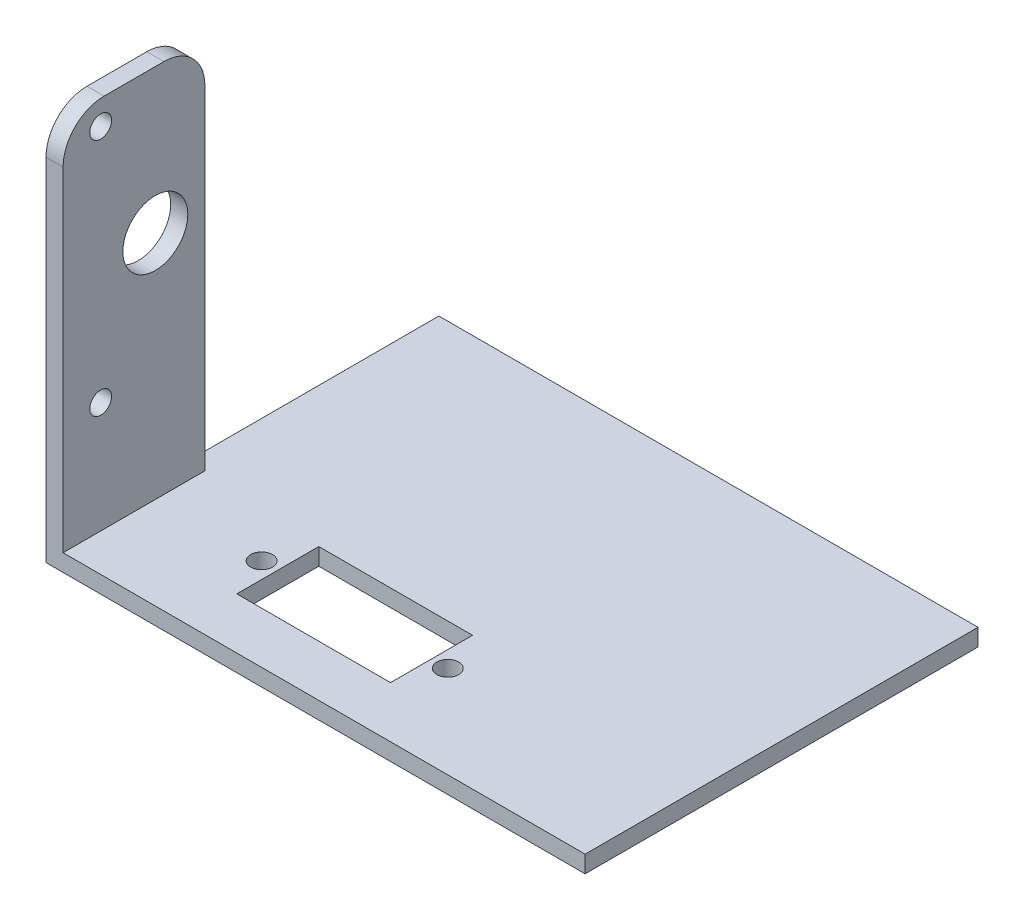
from build123d import *

# Parameters (mm, degrees)
SKETCH1_W               = 80
SKETCH1_H               = 60
BOSS_EXTRUDE1_DEPTH     = 2.5
CUT_EXTRUDE4_DEPTH      = 51.062460986
CUT_EXTRUDE4_DEPTH_BACK = 51.062460986
SKETCH2_R               = 1.6
SKETCH3_W               = 2.5
SKETCH3_H               = 20.5
BOSS_EXTRUDE2_DEPTH     = 66.5
SKETCH4_W               = 80
SKETCH4_H               = 5.5
BOSS_EXTRUDE3_DEPTH     = 2.5
SKETCH5_W               = 2.5
SKETCH5_H               = 5.5
BOSS_EXTRUDE4_DEPTH     = 66.5
SKETCH6_W               = 2.5
SKETCH6_H               = 5.5
CUT_EXTRUDE5_DEPTH      = 66.5
SKETCH9_W               = 2.5
SKETCH9_H               = 2.5
BOSS_EXTRUDE5_DEPTH     = 66.5
SKETCH11_R              = 4.75
CUT_EXTRUDE6_DEPTH      = 2.5
SKETCH15_W              = 2.5
SKETCH15_H              = 23
BOSS_EXTRUDE6_DEPTH     = 8
SKETCH17_W              = 2.5
SKETCH17_H              = 74.5
BOSS_EXTRUDE7_DEPTH     = 2
SKETCH18_R              = 1.6
CUT_EXTRUDE7_DEPTH      = 2.5
SKETCH21_W              = 80
SKETCH21_H              = 2.5
BOSS_EXTRUDE8_DEPTH     = 2
SKETCH22_W              = 4.25
SKETCH22_H              = 74.5
CUT_EXTRUDE8_DEPTH      = 2.5
FILLET1_R               = 5
SKETCH23_W              = 15.225
SKETCH23_H              = 67.5
BOSS_EXTRUDE10_DEPTH    = 2.5
SKETCH24_W              = 95.225
SKETCH24_H              = 10
CUT_EXTRUDE9_DEPTH      = 101.031498164
SKETCH26_W              = 2.5
SKETCH26_H              = 20.75
BOSS_EXTRUDE11_DEPTH    = 74.5
SKETCH27_R              = 1.6
CUT_EXTRUDE10_DEPTH     = 2.5
SKETCH28_W              = 2.5
SKETCH28_H              = 20.75
CUT_EXTRUDE11_DEPTH     = 74.5
SKETCH29_W              = 20.75
SKETCH29_H              = 19.625
CUT_EXTRUDE12_DEPTH     = 2.5
FILLET2_R               = 6
SKETCH31_W              = 13.325
SKETCH31_H              = 57.5
CUT_EXTRUDE13_DEPTH     = 2.5
SKETCH33_W              = 3
SKETCH33_H              = 57.5
CUT_EXTRUDE14_DEPTH     = 2.5


with BuildPart() as part:
    # Sketch1 → Boss-Extrude1 (new body)
    with BuildSketch(Plane(origin=(0, 0, 0), x_dir=(1, 0, 0), z_dir=(0, 1, 0))):
        Rectangle(SKETCH1_W, SKETCH1_H)
    extrude(amount=BOSS_EXTRUDE1_DEPTH)

    # Sketch2 → Cut-Extrude4 (cut, two sides: drawn at the far end of the back side and taken through both)
    with BuildSketch(Plane(origin=(0, 0, 0), x_dir=(1, 0, 0), z_dir=(0, 1, 0)).offset(-CUT_EXTRUDE4_DEPTH_BACK)):
        with BuildLine():
            Line((-6.25, -24), (-2.5, -24))
            ThreePointArc((-2.5, -24), (0, -21.5), (2.5, -24))
            Line((2.5, -24), (16.25, -24))
            Line((16.25, -24), (16.25, -18))
            Line((16.25, -18), (-6.25, -18))
            Line((-6.25, -18), (-6.25, -24))
        make_face()
        with BuildLine():
            Line((0, -26.5), (0, -30))
            Line((0, -30), (16.25, -30))
            Line((16.25, -30), (16.25, -24))
            Line((16.25, -24), (2.5, -24))
            ThreePointArc((2.5, -24), (1.767766953, -25.767766953), (0, -26.5))
        make_face()
        with BuildLine():
            ThreePointArc((-2.5, -24), (-1.767766953, -25.767766953), (0, -26.5))
            Line((0, -26.5), (0, -24))
            Line((0, -24), (-2.5, -24))
        make_face()
        with BuildLine():
            Line((0, -24), (0, -26.5))
            ThreePointArc((0, -26.5), (1.767766953, -25.767766953), (2.5, -24))
            Line((2.5, -24), (0, -24))
        make_face()
        with BuildLine():
            Line((-2.5, -24), (0, -24))
            Line((0, -24), (2.5, -24))
            ThreePointArc((2.5, -24), (0, -21.5), (-2.5, -24))
        make_face()
        with BuildLine():
            ThreePointArc((-2.5, -24), (-1.767766953, -25.767766953), (0, -26.5))
            Line((0, -26.5), (0, -24))
            Line((0, -24), (-2.5, -24))
        make_face()
        with BuildLine():
            Line((0, -24), (0, -26.5))
            ThreePointArc((0, -26.5), (1.767766953, -25.767766953), (2.5, -24))
            Line((2.5, -24), (0, -24))
        make_face()
        with BuildLine():
            Line((-6.25, -30), (0, -30))
            Line((0, -30), (0, -26.5))
            ThreePointArc((0, -26.5), (-1.767766953, -25.767766953), (-2.5, -24))
            Line((-2.5, -24), (-6.25, -24))
            Line((-6.25, -24), (-6.25, -30))
        make_face()
        with Locations(Location((-8.625, -24, 0), (0, 0, 270))):
            Circle(SKETCH2_R)
        with Locations(Location((18.625, -24, 0), (0, 0, 270))):
            Circle(SKETCH2_R)
    extrude(amount=CUT_EXTRUDE4_DEPTH + CUT_EXTRUDE4_DEPTH_BACK, mode=Mode.SUBTRACT)

    # Sketch3 → Boss-Extrude2 (add)
    with BuildSketch(Plane(origin=(0, 2.5, 0), x_dir=(1, 0, 0), z_dir=(0, 1, 0))):
        with Locations((-38.75, -19.75)):
            Rectangle(SKETCH3_W, SKETCH3_H)
    extrude(amount=BOSS_EXTRUDE2_DEPTH)

    # Sketch4 → Boss-Extrude3 (add)
    with BuildSketch(Plane(origin=(0, 2.5, 0), x_dir=(1, 0, 0), z_dir=(0, 1, 0))):
        with Locations((0, -32.75)):
            Rectangle(SKETCH4_W, SKETCH4_H)
    extrude(amount=-BOSS_EXTRUDE3_DEPTH)

    # Sketch5 → Boss-Extrude4 (add)
    with BuildSketch(Plane(origin=(0, 2.5, 0), x_dir=(1, 0, 0), z_dir=(0, 1, 0))):
        with Locations((-38.75, -32.75)):
            Rectangle(SKETCH5_W, SKETCH5_H)
    extrude(amount=BOSS_EXTRUDE4_DEPTH)

    # Sketch6 → Cut-Extrude5 (cut)
    with BuildSketch(Plane(origin=(0, 69, 0), x_dir=(1, 0, 0), z_dir=(0, 1, 0))):
        with Locations((-38.75, -12.25)):
            Rectangle(SKETCH6_W, SKETCH6_H)
    extrude(amount=-CUT_EXTRUDE5_DEPTH, mode=Mode.SUBTRACT)

    # Sketch9 → Boss-Extrude5 (add)
    with BuildSketch(Plane(origin=(0, 2.5, 0), x_dir=(1, 0, 0), z_dir=(0, 1, 0))):
        with Locations((-38.75, -13.75)):
            Rectangle(SKETCH9_W, SKETCH9_H)
    extrude(amount=BOSS_EXTRUDE5_DEPTH)

    # Sketch11 → Cut-Extrude6 (cut)
    with BuildSketch(Plane(origin=(-37.5, 0, 0), x_dir=(0, 0, -1), z_dir=(1, 0, 0))):
        with Locations((-24, 54)):
            Circle(SKETCH11_R)
    extrude(amount=-CUT_EXTRUDE6_DEPTH, mode=Mode.SUBTRACT)

    # Sketch15 → Boss-Extrude6 (add)
    with BuildSketch(Plane(origin=(0, 69, 0), x_dir=(1, 0, 0), z_dir=(0, 1, 0))):
        with Locations((-38.75, -24)):
            Rectangle(SKETCH15_W, SKETCH15_H)
    extrude(amount=BOSS_EXTRUDE6_DEPTH)

    # Sketch17 → Boss-Extrude7 (add)
    with BuildSketch(Plane.XY.offset(35.5)):
        with Locations((-38.75, 39.75)):
            Rectangle(SKETCH17_W, SKETCH17_H)
    extrude(amount=BOSS_EXTRUDE7_DEPTH)

    # Sketch18 → Cut-Extrude7 (cut)
    with BuildSketch(Plane.ZY.offset(40)):
        with Locations((32, 36.5)):
            Circle(SKETCH18_R)
        with Locations((32, 71.5)):
            Circle(SKETCH18_R)
    extrude(amount=-CUT_EXTRUDE7_DEPTH, mode=Mode.SUBTRACT)

    # Sketch21 → Boss-Extrude8 (add)
    with BuildSketch(Plane.XY.offset(35.5)):
        with Locations((0, 1.25)):
            Rectangle(SKETCH21_W, SKETCH21_H)
    extrude(amount=BOSS_EXTRUDE8_DEPTH)

    # Sketch22 → Cut-Extrude8 (cut)
    with BuildSketch(Plane(origin=(-37.5, 0, 0), x_dir=(0, 0, -1), z_dir=(1, 0, 0))):
        with Locations((-14.625, 39.75)):
            Rectangle(SKETCH22_W, SKETCH22_H)
    extrude(amount=-CUT_EXTRUDE8_DEPTH, mode=Mode.SUBTRACT)

    # Fillet1
    fillet1_edges = [part.edges().sort_by_distance(p)[0] for p in [
        (-38.75, 77, 37.5),
        (-38.75, 77, 16.75),
    ]]
    fillet(fillet1_edges, radius=FILLET1_R)

    # Sketch23 → Boss-Extrude10 (add)
    with BuildSketch(Plane(origin=(0, 2.5, 0), x_dir=(1, 0, 0), z_dir=(0, 1, 0))):
        with Locations((47.6125, -3.75)):
            Rectangle(SKETCH23_W, SKETCH23_H)
    extrude(amount=-BOSS_EXTRUDE10_DEPTH)

    # Sketch24 → Cut-Extrude9 (cut, through all)
    with BuildSketch(Plane(origin=(0, 2.5, 0), x_dir=(1, 0, 0), z_dir=(0, 1, 0))):
        with Locations((7.6125, 25)):
            Rectangle(SKETCH24_W, SKETCH24_H)
    extrude(amount=-CUT_EXTRUDE9_DEPTH, mode=Mode.SUBTRACT)

    # Sketch26 → Boss-Extrude11 (add)
    with BuildSketch(Plane(origin=(0, 2.5, 0), x_dir=(1, 0, 0), z_dir=(0, 1, 0))):
        with Locations((-25.425, -27.125)):
            Rectangle(SKETCH26_W, SKETCH26_H)
    extrude(amount=BOSS_EXTRUDE11_DEPTH)

    # Sketch27 → Cut-Extrude10 (cut)
    with BuildSketch(Plane(origin=(-24.175, 0, 0), x_dir=(0, 0, -1), z_dir=(1, 0, 0))):
        with BuildLine():
            ThreePointArc((-28.75, 36.275), (-27.358757211, 32.916242789), (-24, 31.525))
            Line((-24, 31.525), (-24, 36.275))
            Line((-24, 36.275), (-28.75, 36.275))
        make_face()
        with BuildLine():
            Line((-24, 36.275), (-24, 31.525))
            ThreePointArc((-24, 31.525), (-20.641242789, 32.916242789), (-19.25, 36.275))
            ThreePointArc((-19.25, 36.275), (-24, 41.025), (-28.75, 36.275))
            Line((-28.75, 36.275), (-24, 36.275))
        make_face()
        with BuildLine():
            ThreePointArc((-28.75, 36.275), (-27.358757211, 32.916242789), (-24, 31.525))
            Line((-24, 31.525), (-24, 36.275))
            Line((-24, 36.275), (-28.75, 36.275))
        make_face()
        with BuildLine():
            Line((-24, 36.275), (-24, 31.525))
            ThreePointArc((-24, 31.525), (-20.641242789, 32.916242789), (-19.25, 36.275))
            ThreePointArc((-19.25, 36.275), (-24, 41.025), (-28.75, 36.275))
            Line((-28.75, 36.275), (-24, 36.275))
        make_face()
        with Locations((-32, 18.775)):
            Circle(SKETCH27_R)
        with Locations((-32, 53.775)):
            Circle(SKETCH27_R)
    extrude(amount=-CUT_EXTRUDE10_DEPTH, mode=Mode.SUBTRACT)

    # Sketch28 → Cut-Extrude11 (cut)
    with BuildSketch(Plane(origin=(0, 77, 0), x_dir=(1, 0, 0), z_dir=(0, 1, 0))):
        with Locations((-38.75, -27.125)):
            Rectangle(SKETCH28_W, SKETCH28_H)
    extrude(amount=-CUT_EXTRUDE11_DEPTH, mode=Mode.SUBTRACT)

    # Sketch29 → Cut-Extrude12 (cut)
    with BuildSketch(Plane(origin=(-24.175, 0, 0), x_dir=(0, 0, -1), z_dir=(1, 0, 0))):
        with Locations((-27.125, 67.1875)):
            Rectangle(SKETCH29_W, SKETCH29_H)
    extrude(amount=-CUT_EXTRUDE12_DEPTH, mode=Mode.SUBTRACT)

    # Fillet2
    fillet2_edges = [part.edges().sort_by_distance(p)[0] for p in [
        (-25.425, 57.375, 37.5),
        (-25.425, 57.375, 16.75),
    ]]
    fillet(fillet2_edges, radius=FILLET2_R)

    # Sketch31 → Cut-Extrude13 (cut)
    with BuildSketch(Plane(origin=(0, 2.5, 0), x_dir=(1, 0, 0), z_dir=(0, 1, 0))):
        with Locations((-33.3375, -8.75)):
            Rectangle(SKETCH31_W, SKETCH31_H)
    extrude(amount=-CUT_EXTRUDE13_DEPTH, mode=Mode.SUBTRACT)

    # Sketch33 → Cut-Extrude14 (cut)
    with BuildSketch(Plane(origin=(0, 2.5, 0), x_dir=(1, 0, 0), z_dir=(0, 1, 0))):
        with Locations((53.725, -8.75)):
            Rectangle(SKETCH33_W, SKETCH33_H)
    extrude(amount=-CUT_EXTRUDE14_DEPTH, mode=Mode.SUBTRACT)


solid = part.part
